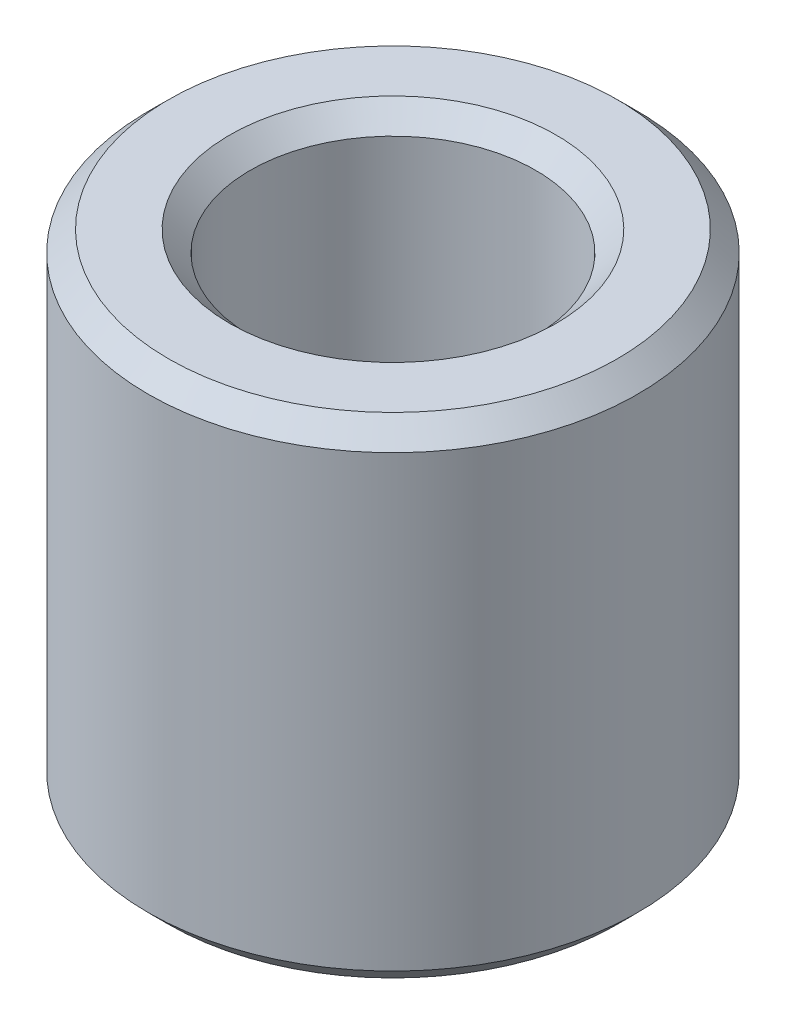
from build123d import *

# Parameters (mm, degrees)
SKETCH1_R           = 3
SKETCH1_R_2         = 1.75
BOSS_EXTRUDE1_DEPTH = 6
CHAMFER1_SIZE       = 0.25


with BuildPart() as part:
    # Sketch1 → Boss-Extrude1 (new body)
    with BuildSketch(Plane(origin=(0, 0, 0), x_dir=(1, 0, 0), z_dir=(0, 1, 0))):
        with Locations(Location((0, 0, 0), (0, 0, 270))):
            Circle(SKETCH1_R)
        with Locations(Location((0, 0, 0), (0, 0, 270))):
            Circle(SKETCH1_R_2, mode=Mode.SUBTRACT)
    extrude(amount=BOSS_EXTRUDE1_DEPTH)

    # Chamfer1
    chamfer1_edges = [part.edges().sort_by_distance(p)[0] for p in [
        (0, 0, -3),
        (0, 6, -3),
        (0, 0, -1.75),
        (0, 6, -1.75),
    ]]
    chamfer(chamfer1_edges, length=CHAMFER1_SIZE)


solid = part.part
